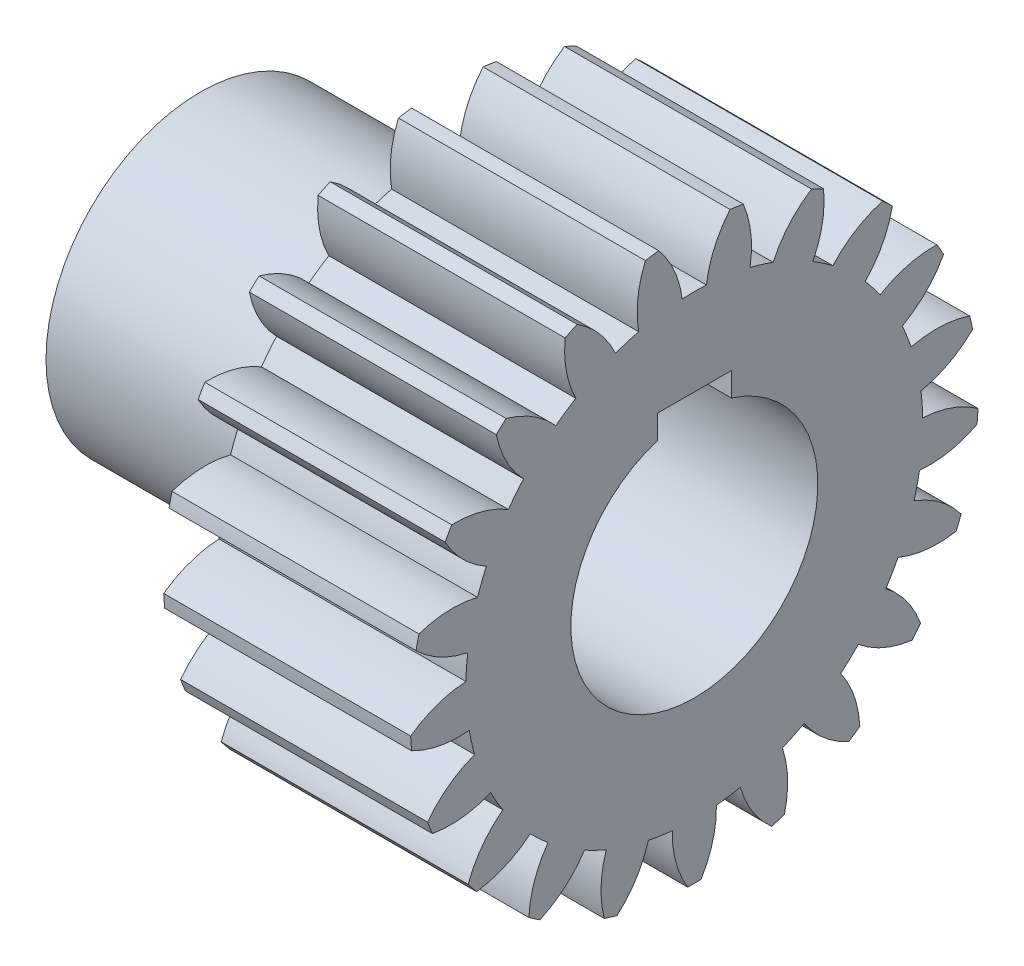
from build123d import *

# Parameters (mm, degrees)
BASPROSKE_W      = 60
BASPROSKE_H      = 69
TOOTHCUT_DEPTH   = 115.551298552
TEETHCUTS_COUNT  = 21
TEETHCUTS_ANGLE  = 342.857142857
HUBNEAONESKE_R   = 37.5
HUBNEARONE_DEPTH = 60.0000508
BORSKE_R         = 30
BORE_DEPTH       = 120.0000508
KEYSKE_W         = 18
KEYSKE_H         = 34.4
KEYWAY_DEPTH     = 120.0000508


with BuildPart() as part:
    # BasProSke → Base-Revolve (revolve)
    with BuildSketch(Plane(origin=(0, 0, 0), x_dir=(1, 0, 0), z_dir=(0, 1, 0)), mode=Mode.PRIVATE) as base_revolve_sk:
        with Locations((30, 34.5)):
            Rectangle(BASPROSKE_W, BASPROSKE_H)
    revolve(base_revolve_sk.sketch.rotate(Axis((-10, 0, 0), (1, 0, 0)), 180), axis=Axis((-10, 0, 0), (1, 0, 0)))

    # TooCutSke → ToothCut (cut, through all)
    with BuildSketch(Plane(origin=(0, 0, 0), x_dir=(0, 0, -1), z_dir=(1, 0, 0))):
        with BuildLine():
            ThreePointArc((2.93985266, 55.421081434), (0, 55.499), (-2.93985266, 55.421081434))
            ThreePointArc((-2.93985266, 55.421081434), (-4.874938915, 62.364127365), (-8.696301499, 68.475398395))
            ThreePointArc((-8.696301499, 68.475398395), (0, 69.0254), (8.696301499, 68.475398395))
            ThreePointArc((8.696301499, 68.475398395), (4.874938915, 62.364127365), (2.93985266, 55.421081434))
        make_face()
    toothcut = extrude(amount=TOOTHCUT_DEPTH, mode=Mode.SUBTRACT)

    # TeethCuts: ToothCut ×21 about axis
    teethcuts_axis = Axis((-10, 0, 0), (1, 0, 0))
    for i in range(1, TEETHCUTS_COUNT):
        add(toothcut.rotate(teethcuts_axis, i * TEETHCUTS_ANGLE / (TEETHCUTS_COUNT - 1)), mode=Mode.SUBTRACT)

    # HubNeaOneSke → HubNearOne (add)
    with BuildSketch(Plane.ZY):
        with Locations(Location((0, 0, 0), (0, 0, 180))):
            Circle(HUBNEAONESKE_R)
    extrude(amount=HUBNEARONE_DEPTH)

    # BorSke → Bore (cut, symmetric)
    with BuildSketch(Plane(origin=(0, 0, 0), x_dir=(0, 0, -1), z_dir=(1, 0, 0))):
        with Locations(Location((0, 0, 0), (0, 0, 180))):
            Circle(BORSKE_R)
    extrude(amount=BORE_DEPTH, both=True, mode=Mode.SUBTRACT)

    # KeySke → Keyway (cut, symmetric)
    with BuildSketch(Plane(origin=(0, 0, 0), x_dir=(0, 0, -1), z_dir=(1, 0, 0))):
        with Locations((0, 17.2)):
            Rectangle(KEYSKE_W, KEYSKE_H)
    extrude(amount=KEYWAY_DEPTH, both=True, mode=Mode.SUBTRACT)


solid = part.part
